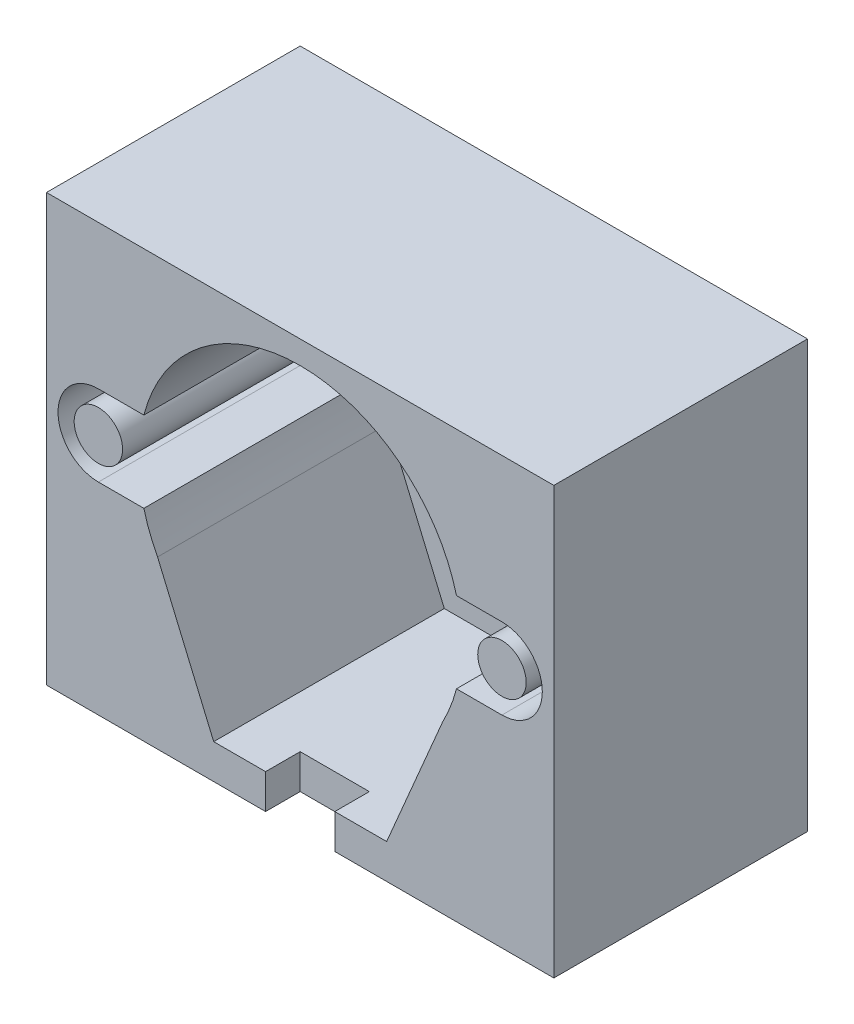
from build123d import *

# Parameters (mm, degrees)
SKETCH_1_W           = 44
SKETCH_1_H           = 37
EXTRUDE_1_DEPTH      = 22
SKETCH_2_R           = 2.1
CUT_EXTRUDE_7_DEPTH  = 20
SKETCH_13_R          = 8
CUT_EXTRUDE_11_DEPTH = 49.342527861
CUT_EXTRUDE_13_REACH = 50.343
SKETCH_15_W          = 6
SKETCH_15_H          = 3


with BuildPart() as part:
    # 草图1 → 凸台-拉伸1 (new body)
    with BuildSketch(Plane.XY):
        with Locations((0, 18.5)):
            Rectangle(SKETCH_1_W, SKETCH_1_H)
    extrude(amount=EXTRUDE_1_DEPTH)

    # 草图2 → 切除-拉伸7 (cut)
    with BuildSketch(Plane.XY.offset(22)):
        with BuildLine():
            Line((-7.5, 3), (7.5, 3))
            Line((7.5, 3), (12.367831524, 14.439760417))
            ThreePointArc((12.367831524, 14.439760417), (13.051639376, 15.934952161), (13.555441712, 17.5))
            Line((13.555441712, 17.5), (17.5, 17.5))
            ThreePointArc((17.5, 17.5), (21, 21), (17.5, 24.5))
            Line((17.5, 24.5), (13.555441712, 24.5))
            ThreePointArc((13.555441712, 24.5), (0, 35), (-13.555441712, 24.5))
            Line((-13.555441712, 24.5), (-17.5, 24.5))
            ThreePointArc((-17.5, 24.5), (-21, 21), (-17.5, 17.5))
            Line((-17.5, 17.5), (-13.555441712, 17.5))
            ThreePointArc((-13.555441712, 17.5), (-13.051639376, 15.934952161), (-12.367831524, 14.439760417))
            Line((-12.367831524, 14.439760417), (-7.5, 3))
        make_face()
        with Locations((-17.5, 21)):
            Circle(SKETCH_2_R, mode=Mode.SUBTRACT)
        with Locations((17.5, 21)):
            Circle(SKETCH_2_R, mode=Mode.SUBTRACT)
    extrude(amount=-CUT_EXTRUDE_7_DEPTH, mode=Mode.SUBTRACT)

    # 草图13 → 切除-拉伸11 (cut, through all)
    with BuildSketch(Plane(origin=(0, 0, 0), x_dir=(-1, 0, 0), z_dir=(0, 0, -1))):
        with Locations((0, 20.914315439)):
            Circle(SKETCH_13_R)
    extrude(amount=-CUT_EXTRUDE_11_DEPTH, mode=Mode.SUBTRACT)

    # 草图15 → 切除-拉伸13 (cut, up to next)
    with BuildSketch(Plane.XZ, mode=Mode.PRIVATE) as cut_extrude_13_sk1:
        with Locations((0, 20.5)):
            Rectangle(SKETCH_15_W, SKETCH_15_H)
    cut_extrude_13_tool1 = extrude(cut_extrude_13_sk1.sketch, amount=-CUT_EXTRUDE_13_REACH, mode=Mode.PRIVATE) & part.part
    add(cut_extrude_13_tool1.solids().sort_by_distance((0, 0, 20.5))[0], mode=Mode.SUBTRACT)


solid = part.part
